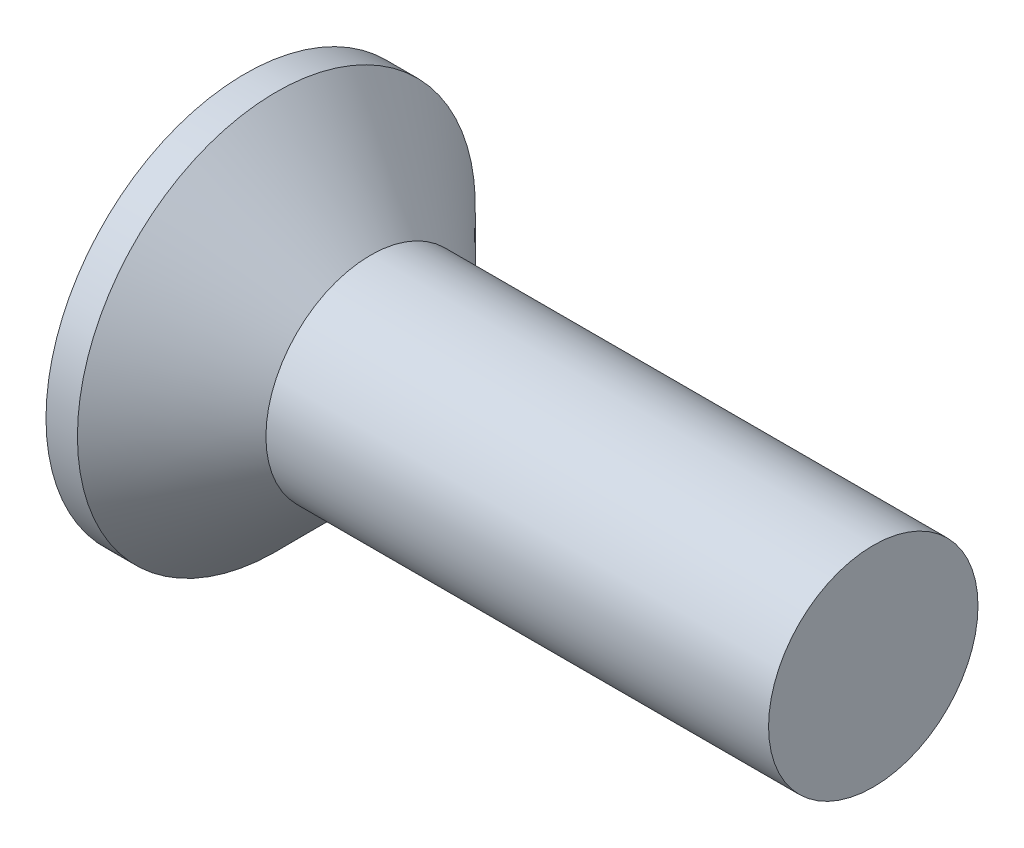
from build123d import *


with BuildPart() as part:
    # Esquisse1 → Révolution1 (revolve)
    with BuildSketch(Plane.XY, mode=Mode.PRIVATE) as r_volution1_sk:
        Polygon((0, 0), (6, 0), (6, 1), (1.2, 1), (0.3, 1.9), (0, 1.9), align=None)
    revolve(r_volution1_sk.sketch.rotate(Axis((0, 0, 0), (1, 0, 0)), 90), axis=Axis((0, 0, 0), (1, 0, 0)))


solid = part.part
